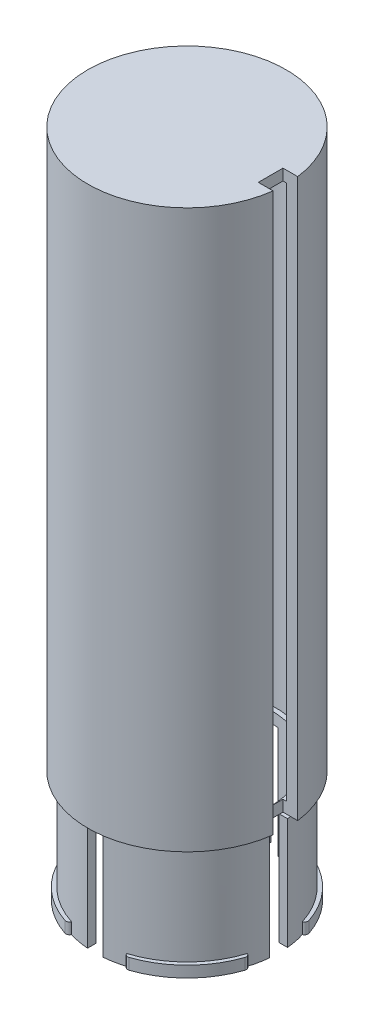
from build123d import *

# Parameters (mm, degrees)
SKETCH1_R           = 17.78
BOSS_EXTRUDE1_DEPTH = 100
SHELL1_T            = 2
CUT_EXTRUDE1_START  = 20
SKETCH2_W           = 4.427976762
SKETCH2_H           = 104.269834735
CUT_EXTRUDE1_DEPTH  = 5
SKETCH4_R           = 16.51
BOSS_EXTRUDE2_DEPTH = 20
SKETCH7_R           = 14.953216008
CUT_EXTRUDE4_DEPTH  = 32
SKETCH8_W           = 2.785852998
SKETCH8_H           = 3.149177074
SKETCH8_W_2         = 3.149177073
SKETCH8_H_2         = 3.205412378
SKETCH8_H_3         = 3.711530123
CUT_EXTRUDE5_DEPTH  = 104.112835283
BOSS_EXTRUDE4_DEPTH = 2


with BuildPart() as part:
    # Sketch1 → Boss-Extrude1 (new body)
    with BuildSketch(Plane(origin=(0, 0, 0), x_dir=(1, 0, 0), z_dir=(0, 1, 0))):
        with Locations(Location((0, 0, 0), (0, 0, 90))):
            Circle(SKETCH1_R)
    extrude(amount=BOSS_EXTRUDE1_DEPTH)

    # Shell1 (no face opened: a closed hollow body)
    add(offset(amount=-SHELL1_T, mode=Mode.PRIVATE), mode=Mode.SUBTRACT)

    # Sketch2 → Cut-Extrude1 (cut, symmetric)
    with BuildSketch(Plane(origin=(0, 0, 0), x_dir=(0, 0, -1), z_dir=(1, 0, 0)).offset(CUT_EXTRUDE1_START)):
        with Locations((0, 52.134917368)):
            Rectangle(SKETCH2_W, SKETCH2_H)
    extrude(amount=CUT_EXTRUDE1_DEPTH, both=True, mode=Mode.SUBTRACT)

    # Sketch4 → Boss-Extrude2 (add)
    with BuildSketch(Plane.XZ):
        with Locations(Location((0, 0, 0), (0, 0, 7.706571309))):
            Circle(SKETCH4_R)
    extrude(amount=BOSS_EXTRUDE2_DEPTH)

    # Sketch7 → Cut-Extrude4 (cut)
    with BuildSketch(Plane(origin=(0, -20, 0), x_dir=(-1, 0, 0), z_dir=(0, -1, 0))):
        with Locations(Location((0, 0, 0), (0, 0, 90))):
            Circle(SKETCH7_R)
    extrude(amount=-CUT_EXTRUDE4_DEPTH, mode=Mode.SUBTRACT)

    # Sketch8 → Cut-Extrude5 (cut, through all)
    with BuildSketch(Plane(origin=(0, 0, 0), x_dir=(1, 0, 0), z_dir=(0, 1, 0))):
        with Locations((0, 15.774003019)):
            Rectangle(SKETCH8_W, SKETCH8_H)
        with Locations((15.845399854, 0)):
            Rectangle(SKETCH8_W_2, SKETCH8_H_2)
        with Locations((0, -16.055179544)):
            Rectangle(SKETCH8_W, SKETCH8_H_3)
        with Locations((-15.845399854, 0)):
            Rectangle(SKETCH8_W_2, SKETCH8_H_2)
    extrude(amount=-CUT_EXTRUDE5_DEPTH, mode=Mode.SUBTRACT)

    # Sketch9 → Boss-Extrude4 (add)
    with BuildSketch(Plane.XZ.offset(20)):
        with BuildLine():
            ThreePointArc((16.14116018, 5.756014083), (12.168131115, 12.163725441), (5.760419757, 16.136754506))
            ThreePointArc((5.760419757, 16.136754506), (4.92620467, 15.722665224), (5.340293953, 14.888450137))
            ThreePointArc((5.340293953, 14.888450137), (11.236796189, 11.232390515), (14.892855811, 5.335888279))
            ThreePointArc((14.892855811, 5.335888279), (15.727070898, 4.921798996), (16.14116018, 5.756014083))
        make_face()
        with BuildLine():
            ThreePointArc((16.14116018, -5.756014083), (12.168131115, -12.163725441), (5.760419757, -16.136754506))
            ThreePointArc((5.760419757, -16.136754506), (4.92620467, -15.722665224), (5.340293953, -14.888450137))
            ThreePointArc((5.340293953, -14.888450137), (11.236796189, -11.232390515), (14.892855811, -5.335888279))
            ThreePointArc((14.892855811, -5.335888279), (15.727070898, -4.921798996), (16.14116018, -5.756014083))
        make_face()
        with BuildLine():
            ThreePointArc((-16.14116018, -5.756014083), (-12.168131115, -12.163725441), (-5.760419757, -16.136754506))
            ThreePointArc((-5.760419757, -16.136754506), (-4.92620467, -15.722665224), (-5.340293953, -14.888450137))
            ThreePointArc((-5.340293953, -14.888450137), (-11.236796189, -11.232390515), (-14.892855811, -5.335888279))
            ThreePointArc((-14.892855811, -5.335888279), (-15.727070898, -4.921798996), (-16.14116018, -5.756014083))
        make_face()
        with BuildLine():
            ThreePointArc((-16.14116018, 5.756014083), (-12.168131115, 12.163725441), (-5.760419757, 16.136754506))
            ThreePointArc((-5.760419757, 16.136754506), (-4.92620467, 15.722665224), (-5.340293953, 14.888450137))
            ThreePointArc((-5.340293953, 14.888450137), (-11.236796189, 11.232390515), (-14.892855811, 5.335888279))
            ThreePointArc((-14.892855811, 5.335888279), (-15.727070898, 4.921798996), (-16.14116018, 5.756014083))
        make_face()
    extrude(amount=-BOSS_EXTRUDE4_DEPTH)


solid = part.part
